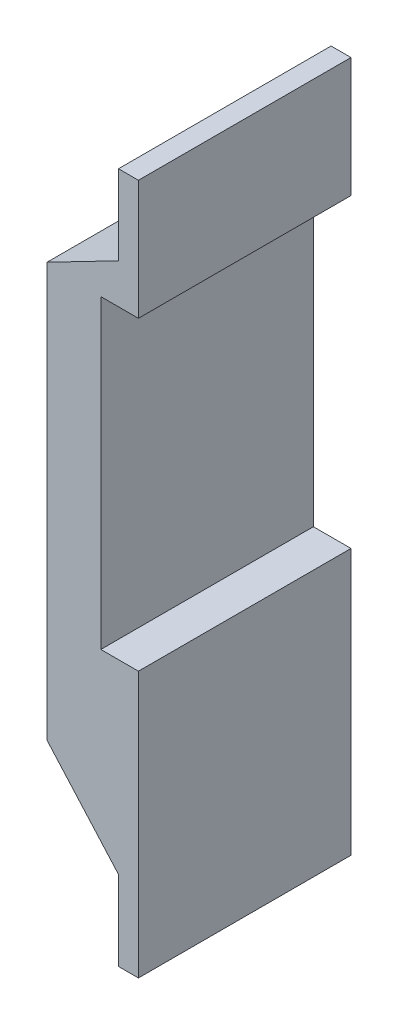
from build123d import *

# Parameters (mm, degrees)
BOSS_EXTRUDE1_DEPTH = 16


with BuildPart() as part:
    # Sketch1 → Boss-Extrude1 (new body)
    with BuildSketch(Plane.XY):
        Polygon((-5.381531959, 13.886562136), (-5.381531959, -17.267273157), (0, -23.327273157), (0, -29.327273157), (1.5, -29.327273157), (1.5, -9.327273157), (-1.33, -9.327273157), (-1.33, 13.672726843), (1.5, 13.672726843), (1.5, 22.672726843), (0, 22.672726843), (0, 16.672726843), align=None)
    extrude(amount=BOSS_EXTRUDE1_DEPTH)


solid = part.part
